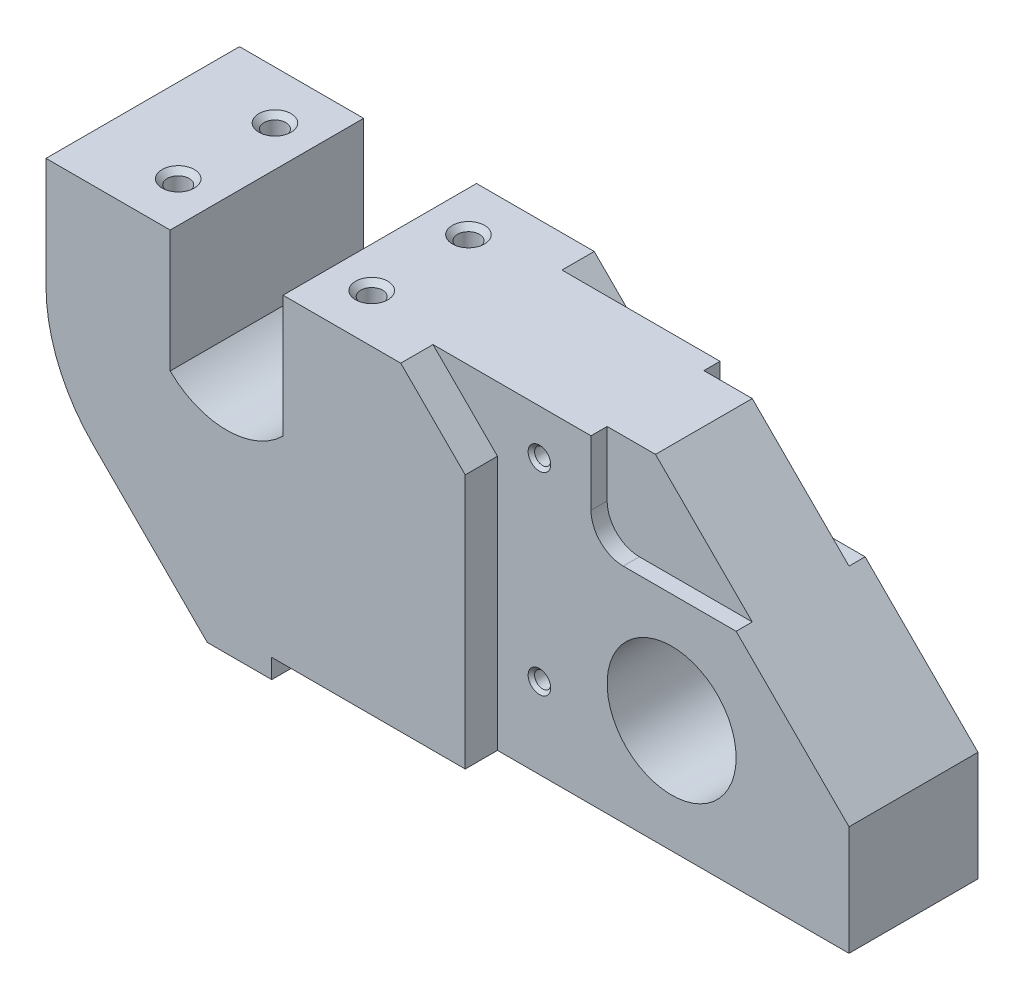
from build123d import *

# Parameters (mm, degrees)
SKETCH_5_W                  = 239
SKETCH_5_H                  = 105
EXTRUDE_1_DEPTH             = 20
EXTRUDE_2_DEPTH             = 10
SKETCH_8_W                  = 169
SKETCH_8_H                  = 6
CUT_EXTRUDE_6_DEPTH         = 208.879772946
CUT_EXTRUDE_7_DEPTH         = 204.99509798
CUT_EXTRUDE_7_DEPTH_BACK    = 204.99509798
HOLE_WIZARD_M82_D           = 6.8
HOLE_WIZARD_M82_DEPTH       = 25
HOLE_WIZARD_M82_CSINK_D     = 10
HOLE_WIZARD_M82_CSINK_ANGLE = 90
HOLE_WIZARD_M82_TIP         = 2.042926105
CHAMFER_1_SIZE              = 65
CHAMFER_2_SIZE              = 20
CUT_EXTRUDE_8_DEPTH         = 5
HOLE_WIZARD_M81_D           = 6.8
HOLE_WIZARD_M81_DEPTH       = 23.957073895
HOLE_WIZARD_M81_CSINK_D     = 10
HOLE_WIZARD_M81_CSINK_ANGLE = 90
HOLE_WIZARD_M81_TIP         = 2.042926105
HOLE_WIZARD_M61_D           = 5
HOLE_WIZARD_M61_CSINK_D     = 7
HOLE_WIZARD_M61_CSINK_ANGLE = 90
CUT_EXTRUDE_9_REACH         = 209.88
SKETCH_21_R                 = 20
FILLET_1_R                  = 10
CHAMFER_3_SIZE              = 50
FILLET_2_R                  = 50


with BuildPart() as part:
    # Эскиз5 → Бобышка-Вытянуть1 (new, symmetric)
    with BuildSketch(Plane.XY):
        with Locations((63.5, -32.5)):
            Rectangle(SKETCH_5_W, SKETCH_5_H)
    extrude(amount=EXTRUDE_1_DEPTH, both=True)

    # Эскиз10 → Бобышка-Вытянуть2 (add)
    with BuildSketch(Plane.XY.offset(20)):
        Polygon((-56, 20), (74, 20), (74, -79), (14, -79), (14, -85), (-56, -85), align=None)
    extrude_2 = extrude(amount=EXTRUDE_2_DEPTH)

    # Зеркальное отражение1: Бобышка-Вытянуть2 across plane
    add(extrude_2.mirror(Plane.XY))

    # Эскиз8 → Вырез-Вытянуть6 (cut, through all)
    with BuildSketch(Plane.XY.offset(20)):
        with Locations((98.5, -82)):
            Rectangle(SKETCH_8_W, SKETCH_8_H)
    extrude(amount=-CUT_EXTRUDE_6_DEPTH, mode=Mode.SUBTRACT)

    # Эскиз4 → Вырез-Вытянуть7 (cut, two sides: drawn at the far end of the back side and taken through both)
    with BuildSketch(Plane.XY.offset(-CUT_EXTRUDE_7_DEPTH_BACK)):
        with BuildLine():
            Line((-17.5, 20), (17.5, 20))
            Line((17.5, 20), (17.5, -17.853571071))
            ThreePointArc((17.5, -17.853571071), (0, -25), (-17.5, -17.853571071))
            Line((-17.5, -17.853571071), (-17.5, 20))
        make_face()
    extrude(amount=CUT_EXTRUDE_7_DEPTH + CUT_EXTRUDE_7_DEPTH_BACK, mode=Mode.SUBTRACT)

    # Отверстие обработанное метчиком M82
    with Locations(Plane(origin=(0, -79, 0), x_dir=(-1, 0, 0), z_dir=(0, -1, 0))):
        with Locations((-29, 17.5), (-29, -17.5), (-79, 0), (-169, 0)):
            CounterSinkHole(HOLE_WIZARD_M82_D / 2, HOLE_WIZARD_M82_CSINK_D / 2, depth=HOLE_WIZARD_M82_DEPTH, counter_sink_angle=HOLE_WIZARD_M82_CSINK_ANGLE)
            with Locations((0, 0, -(HOLE_WIZARD_M82_DEPTH + HOLE_WIZARD_M82_TIP / 2))):  # 118° drill point
                Cone(0, HOLE_WIZARD_M82_D / 2, HOLE_WIZARD_M82_TIP, mode=Mode.SUBTRACT)

    # Фаска1
    chamfer_1_edges = [part.edges().sort_by_distance(p)[0] for p in [
        (183, 20, 0),
    ]]
    chamfer(chamfer_1_edges, length=CHAMFER_1_SIZE)

    # Фаска2
    chamfer_2_edges = [part.edges().sort_by_distance(p)[0] for p in [
        (74, 20, 25),
        (74, 20, -25),
    ]]
    chamfer(chamfer_2_edges, length=CHAMFER_2_SIZE)

    # Эскиз14 → Вырез-Вытянуть8 (cut)
    with BuildSketch(Plane.XY.offset(20)):
        Polygon((118, 20), (103, 20), (103, -10), (148, -10), align=None)
    cut_extrude_8 = extrude(amount=-CUT_EXTRUDE_8_DEPTH, mode=Mode.SUBTRACT)

    # Отверстие обработанное метчиком M81
    with Locations(Plane(origin=(0, 20, 0), x_dir=(1, 0, 0), z_dir=(0, 1, 0))):
        with Locations((-30, -15), (30, -15), (-30, 15), (30, 15)):
            CounterSinkHole(HOLE_WIZARD_M81_D / 2, HOLE_WIZARD_M81_CSINK_D / 2, depth=HOLE_WIZARD_M81_DEPTH, counter_sink_angle=HOLE_WIZARD_M81_CSINK_ANGLE)
            with Locations((0, 0, -(HOLE_WIZARD_M81_DEPTH + HOLE_WIZARD_M81_TIP / 2))):  # 118° drill point
                Cone(0, HOLE_WIZARD_M81_D / 2, HOLE_WIZARD_M81_TIP, mode=Mode.SUBTRACT)

    # Зеркальное отражение2: Вырез-Вытянуть8 across plane
    add(cut_extrude_8.mirror(Plane.XY), mode=Mode.SUBTRACT)

    # Отверстие обработанное метчиком M61 (through all)
    with Locations(Plane.XY.offset(20)):
        with Locations((87, -54), (87, 6)):
            hole_wizard_m61 = CounterSinkHole(HOLE_WIZARD_M61_D / 2, HOLE_WIZARD_M61_CSINK_D / 2, counter_sink_angle=HOLE_WIZARD_M61_CSINK_ANGLE)

    # Зеркальное отражение3: Отверстие обработанное метчиком M61 across plane
    add(hole_wizard_m61.mirror(Plane.XY), mode=Mode.SUBTRACT)

    # Эскиз21 → Вырез-Вытянуть9 (cut, up to next)
    with BuildSketch(Plane.XY.offset(20), mode=Mode.PRIVATE) as cut_extrude_9_sk1:
        with Locations((128, -44)):
            Circle(SKETCH_21_R)
    cut_extrude_9_tool1 = extrude(cut_extrude_9_sk1.sketch, amount=-CUT_EXTRUDE_9_REACH, mode=Mode.PRIVATE) & part.part
    add(cut_extrude_9_tool1.solids().sort_by_distance((128, -44, 20))[0], mode=Mode.SUBTRACT)

    # Скругление1
    fillet_1_edges = [part.edges().sort_by_distance(p)[0] for p in [
        (103, -10, 17.5),
        (103, -10, -17.5),
    ]]
    fillet(fillet_1_edges, radius=FILLET_1_R)

    # Фаска3
    chamfer_3_edges = [part.edges().sort_by_distance(p)[0] for p in [
        (-56, -85, 0),
    ]]
    chamfer(chamfer_3_edges, length=CHAMFER_3_SIZE)

    # Скругление2
    fillet_2_edges = [part.edges().sort_by_distance(p)[0] for p in [
        (-56, -35, 0),
    ]]
    fillet(fillet_2_edges, radius=FILLET_2_R)


solid = part.part
